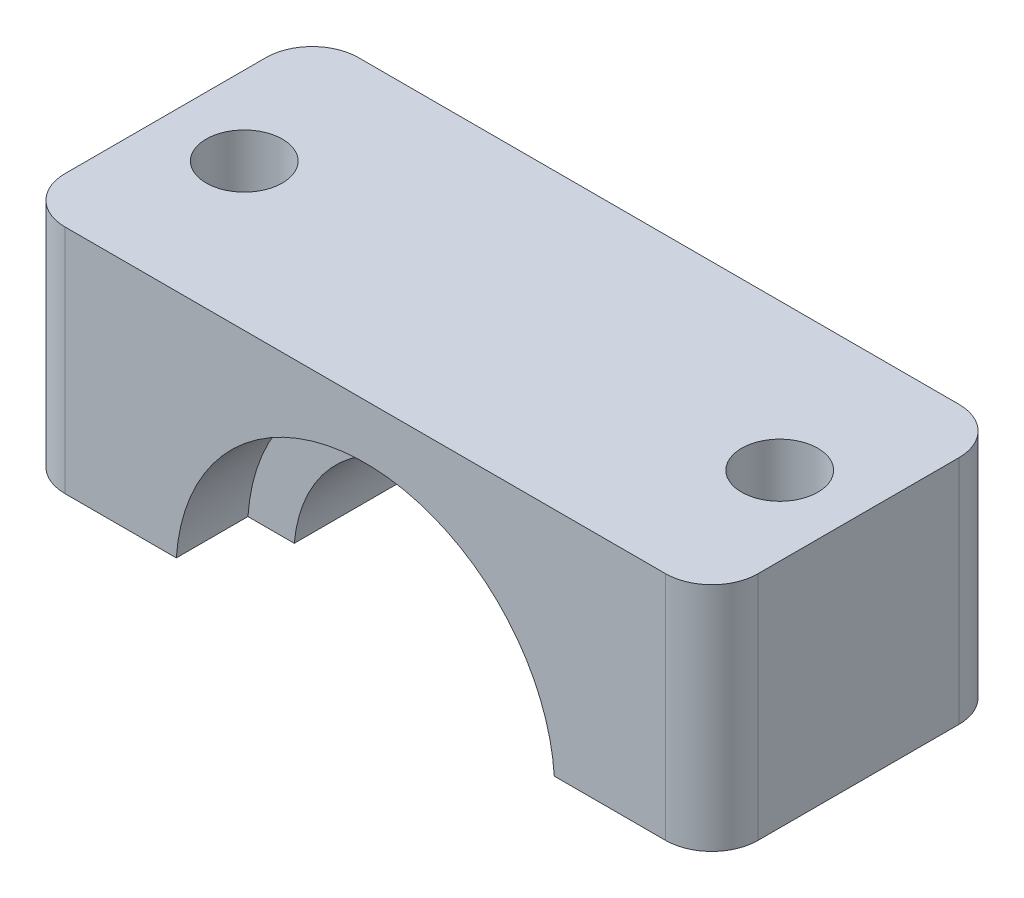
from build123d import *

# Parameters (mm, degrees)
SKETCH1_W               = 30
SKETCH1_H               = 12.7
BOSS_EXTRUDE1_DEPTH     = 10
SKETCH2_R               = 8.2
CUT_EXTRUDE1_DEPTH      = 3.8
CUT_EXTRUDE2_START      = -3.1
SKETCH3_R               = 8.2
CUT_EXTRUDE2_DEPTH      = 3.1
CUT_EXTRUDE3_DEPTH      = 21.424495098
CUT_EXTRUDE3_DEPTH_BACK = 21.424495098
SKETCH4_R               = 6.2
FILLET1_R               = 2
SKETCH5_R               = 1.65
CUT_EXTRUDE4_DEPTH      = 20.113411522


with BuildPart() as part:
    # Sketch1 → Boss-Extrude1 (new body)
    with BuildSketch(Plane(origin=(0, 0, 0), x_dir=(1, 0, 0), z_dir=(0, 1, 0))):
        Rectangle(SKETCH1_W, SKETCH1_H)
    extrude(amount=BOSS_EXTRUDE1_DEPTH)

    # Sketch2 → Cut-Extrude1 (cut)
    with BuildSketch(Plane(origin=(0, 0, -6.35), x_dir=(-1, 0, 0), z_dir=(0, 0, -1))):
        with Locations((0, -0.55)):
            Circle(SKETCH2_R)
    extrude(amount=-CUT_EXTRUDE1_DEPTH, mode=Mode.SUBTRACT)

    # Sketch3 → Cut-Extrude2 (cut)
    with BuildSketch(Plane.XY.offset(6.35).offset(CUT_EXTRUDE2_START)):
        with Locations((0, -0.55)):
            Circle(SKETCH3_R)
    extrude(amount=CUT_EXTRUDE2_DEPTH, mode=Mode.SUBTRACT)

    # Sketch4 → Cut-Extrude3 (cut, two sides: drawn at the far end of the back side and taken through both)
    with BuildSketch(Plane.XY.offset(3.25).offset(-CUT_EXTRUDE3_DEPTH_BACK)):
        with Locations((0, -0.55)):
            Circle(SKETCH4_R)
    extrude(amount=CUT_EXTRUDE3_DEPTH + CUT_EXTRUDE3_DEPTH_BACK, mode=Mode.SUBTRACT)

    # Fillet1
    fillet1_edges = [part.edges().sort_by_distance(p)[0] for p in [
        (15, 5, 6.35),
        (-15, 5, 6.35),
        (-15, 5, -6.35),
        (15, 5, -6.35),
    ]]
    fillet(fillet1_edges, radius=FILLET1_R)

    # Sketch5 → Cut-Extrude4 (cut, symmetric)
    with BuildSketch(Plane.XZ):
        with Locations(Location((-11.590767043, 0, 0), (0, 0, 270))):
            Circle(SKETCH5_R)
    cut_extrude4 = extrude(amount=CUT_EXTRUDE4_DEPTH, both=True, mode=Mode.SUBTRACT)

    # Mirror1: Cut-Extrude4 across plane
    add(cut_extrude4.mirror(Plane(origin=(0, 0, 0), x_dir=(0, 0, 1), z_dir=(1, 0, 0))), mode=Mode.SUBTRACT)


solid = part.part
